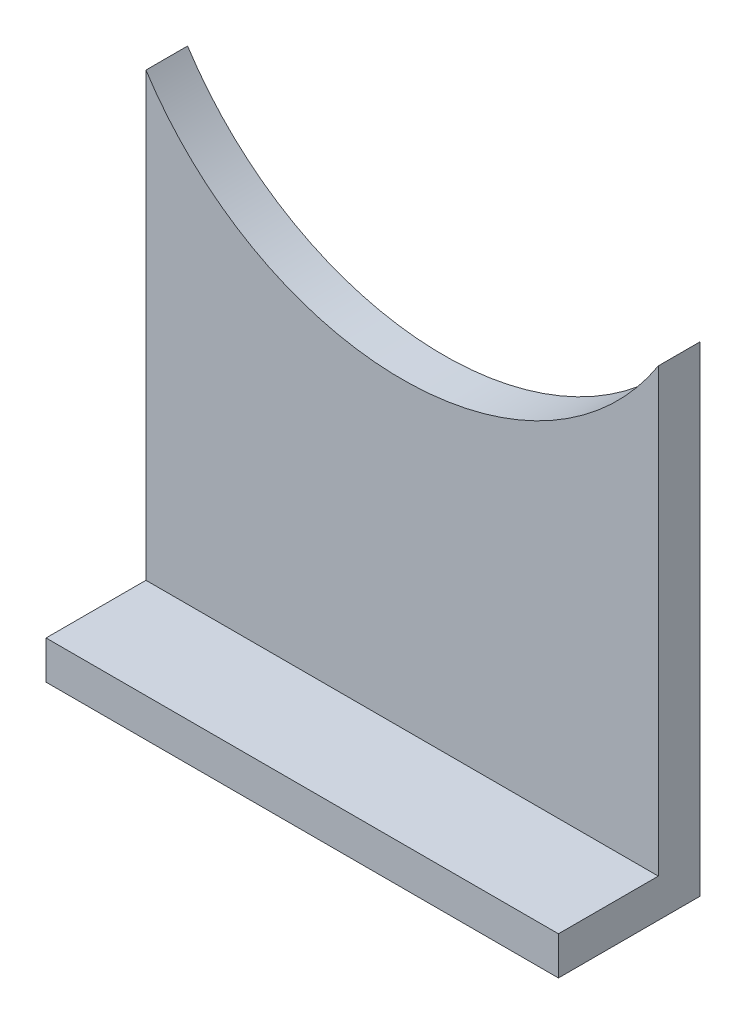
from build123d import *

# Parameters (mm, degrees)
BOSS_EXTRUDE1_DEPTH = 63.5
SKETCH3_W           = 781.722843432
SKETCH3_H           = 58.42
BOSS_EXTRUDE2_DEPTH = 152.4


with BuildPart() as part:
    # Sketch2 → Boss-Extrude1 (new body)
    with BuildSketch(Plane.XY):
        with BuildLine():
            Line((390.861421716, -251.565063977), (390.861421716, -984.152448319))
            Line((390.861421716, -984.152448319), (-390.861421716, -984.152448319))
            Line((-390.861421716, -984.152448319), (-390.861421716, -251.565063977))
            ThreePointArc((-390.861421716, -251.565063977), (0, -464.82), (390.861421716, -251.565063977))
        make_face()
    extrude(amount=BOSS_EXTRUDE1_DEPTH)

    # Sketch3 → Boss-Extrude2 (add)
    with BuildSketch(Plane.XY.offset(63.5)):
        with Locations((0, -954.942448319)):
            Rectangle(SKETCH3_W, SKETCH3_H)
    extrude(amount=BOSS_EXTRUDE2_DEPTH)


solid = part.part
